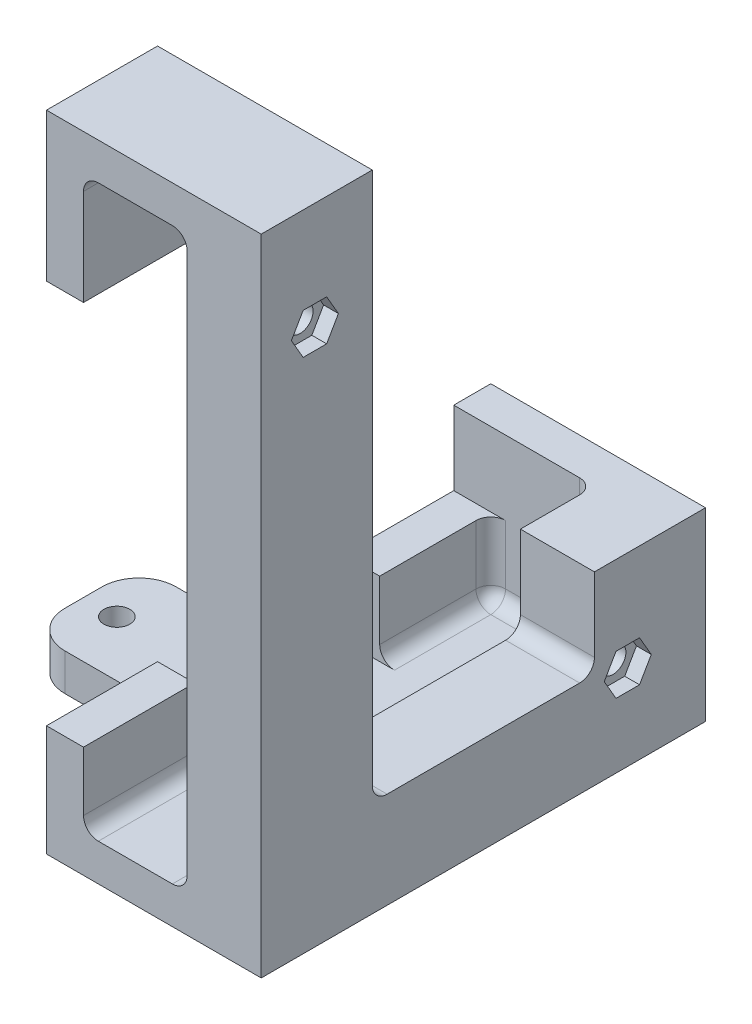
from build123d import *

# Parameters (mm, degrees)
BOSS_EXTRUDE1_DEPTH     = 15
BOSS_EXTRUDE2_DEPTH     = 60
SKETCH3_W               = 24
SKETCH3_H               = 25
BOSS_EXTRUDE3_DEPTH     = 5
FILLET1_R               = 2
CUT_EXTRUDE1_DEPTH      = 109.374351209
CUT_EXTRUDE1_DEPTH_BACK = 9
SKETCH5_W               = 30
SKETCH5_H               = 12
CUT_EXTRUDE2_DEPTH      = 9
FILLET2_R               = 2
FILLET3_R               = 2
FILLET4_R               = 2
SKETCH6_W               = 15
SKETCH6_H               = 10
BOSS_EXTRUDE4_DEPTH     = 5
FILLET5_R               = 2
BOSS_EXTRUDE6_START     = 5
BOSS_EXTRUDE6_DEPTH     = 5
SKETCH11_R              = 1.75
CUT_EXTRUDE6_DEPTH      = 17
CUT_EXTRUDE7_DEPTH      = 2
SKETCH16_R              = 1.75
BOSS_EXTRUDE7_DEPTH     = 5
SKETCH17_W              = 5
SKETCH17_H              = 35
BOSS_EXTRUDE8_DEPTH     = 10
FILLET6_R               = 2


with BuildPart() as part:
    # Sketch1 → Boss-Extrude1 (new body)
    with BuildSketch(Plane.XY):
        with BuildLine():
            Line((0, 0), (0, 87))
            Line((0, 87), (-24, 87))
            Line((-24, 87), (-24, 67))
            Line((-24, 67), (-19, 67))
            Line((-19, 67), (-19, 80))
            ThreePointArc((-19, 80), (-18.414213562, 81.414213562), (-17, 82))
            Line((-17, 82), (-7, 82))
            ThreePointArc((-7, 82), (-5.585786438, 81.414213562), (-5, 80))
            Line((-5, 80), (-5, 75.913258959))
            Line((-5, 75.913258959), (-5, 0))
            Line((-5, 0), (0, 0))
        make_face()
    extrude(amount=-BOSS_EXTRUDE1_DEPTH)

    # Sketch2 → Boss-Extrude2 (add)
    with BuildSketch(Plane.XY):
        Polygon((-5, 0), (-24, 0), (-24, 0.85250732), (-24, 15), (-19, 15), (-19, 5), (-5, 5), (-5, 25), (0, 25), (0, 0), align=None)
    extrude(amount=-BOSS_EXTRUDE2_DEPTH)

    # Sketch3 → Boss-Extrude3 (add)
    with BuildSketch(Plane(origin=(0, 0, -60), x_dir=(-1, 0, 0), z_dir=(0, 0, -1))):
        with Locations((12, 12.5)):
            Rectangle(SKETCH3_W, SKETCH3_H)
    extrude(amount=-BOSS_EXTRUDE3_DEPTH)

    # Fillet1
    fillet1_edges = [part.edges().sort_by_distance(p)[0] for p in [
        (-5, 5, -27.5),
        (-19, 5, -27.5),
    ]]
    fillet(fillet1_edges, radius=FILLET1_R)

    # Sketch4 → Cut-Extrude1 (cut, two sides: drawn at the far end of the back side and taken through both)
    with BuildSketch(Plane.ZY.offset(24).offset(-CUT_EXTRUDE1_DEPTH_BACK)):
        Polygon((-55, 206.20706388), (-55, 15), (-55, 5), (-15, 5), (-15, 15), (-15, 206.20706388), (-15, 588.62119164), (-55, 588.62119164), align=None)
    extrude(amount=CUT_EXTRUDE1_DEPTH + CUT_EXTRUDE1_DEPTH_BACK, mode=Mode.SUBTRACT)

    # Sketch5 → Cut-Extrude2 (cut)
    with BuildSketch(Plane.ZY.offset(5)):
        with Locations((-30, 19)):
            Rectangle(SKETCH5_W, SKETCH5_H)
    extrude(amount=-CUT_EXTRUDE2_DEPTH, mode=Mode.SUBTRACT)

    # Fillet2
    fillet2_edges = [part.edges().sort_by_distance(p)[0] for p in [
        (-5, 16, -55),
        (-15.5, 5, -55),
        (-5.585786438, 5.585786438, -55),
    ]]
    fillet(fillet2_edges, radius=FILLET2_R)

    # Fillet3
    fillet3_edges = [part.edges().sort_by_distance(p)[0] for p in [
        (-2.5, 13, -45),
    ]]
    fillet(fillet3_edges, radius=FILLET3_R)

    # Fillet4
    fillet4_edges = [part.edges().sort_by_distance(p)[0] for p in [
        (-2.5, 13, -15),
    ]]
    fillet(fillet4_edges, radius=FILLET4_R)

    # Sketch6 → Boss-Extrude4 (add)
    with BuildSketch(Plane.ZY.offset(24)):
        with Locations((-47.5, 10)):
            Rectangle(SKETCH6_W, SKETCH6_H)
    extrude(amount=-BOSS_EXTRUDE4_DEPTH)

    # Fillet5
    fillet5_edges = [part.edges().sort_by_distance(p)[0] for p in [
        (-19, 5.585786438, -54.414213562),
        (-19, 11, -55),
        (-19, 5, -46.5),
    ]]
    fillet(fillet5_edges, radius=FILLET5_R)

    # Sketch10 → Boss-Extrude6 (add)
    with BuildSketch(Plane(origin=(0, 0, 0), x_dir=(0, 0, -1), z_dir=(1, 0, 0)).offset(BOSS_EXTRUDE6_START)):
        with BuildLine():
            Line((43, 13), (17, 13))
            ThreePointArc((17, 13), (15.585786438, 13.585786438), (15, 15))
            Line((15, 15), (15, 87))
            Line((15, 87), (0, 87))
            Line((0, 87), (0, 0))
            Line((0, 0), (60, 0))
            Line((60, 0), (60, 25))
            Line((60, 25), (45, 25))
            Line((45, 25), (45, 15))
            ThreePointArc((45, 15), (44.414213562, 13.585786438), (43, 13))
        make_face()
    extrude(amount=-BOSS_EXTRUDE6_DEPTH)

    # Sketch11 → Cut-Extrude6 (cut)
    with BuildSketch(Plane(origin=(5, 0, 0), x_dir=(0, 0, -1), z_dir=(1, 0, 0))):
        with Locations(Location((49.5, 11.5, 0), (0, 0, 90))):
            Circle(SKETCH11_R)
        with Locations(Location((7.248390946, 72.5, 0), (0, 0, 90))):
            Circle(SKETCH11_R)
    extrude(amount=-CUT_EXTRUDE6_DEPTH, mode=Mode.SUBTRACT)

    # Sketch14 → Cut-Extrude7 (cut)
    with BuildSketch(Plane(origin=(5, 0, 0), x_dir=(0, 0, -1), z_dir=(1, 0, 0))):
        Polygon((10.423817427, 72.5), (8.836104186, 75.25), (5.660677706, 75.25), (4.072964465, 72.5), (5.660677706, 69.75), (8.836104186, 69.75), align=None)
        Polygon((52.675426481, 11.5), (51.08771324, 14.25), (47.91228676, 14.25), (46.324573519, 11.5), (47.91228676, 8.75), (51.08771324, 8.75), align=None)
    extrude(amount=-CUT_EXTRUDE7_DEPTH, mode=Mode.SUBTRACT)

    # Sketch16 → Boss-Extrude7 (add)
    with BuildSketch(Plane(origin=(0, 0, 0), x_dir=(1, 0, 0), z_dir=(0, 1, 0))):
        with BuildLine():
            Line((-24, 35), (-41.5, 35))
            ThreePointArc((-41.5, 35), (-45.035533906, 33.535533906), (-46.5, 30))
            Line((-46.5, 30), (-46.5, 25))
            ThreePointArc((-46.5, 25), (-45.035533906, 21.464466094), (-41.5, 20))
            Line((-41.5, 20), (-24, 20))
            Line((-24, 20), (-24, 35))
        make_face()
        with Locations(Location((-42, 27.5, 0), (0, 0, 180))):
            Circle(SKETCH16_R, mode=Mode.SUBTRACT)
    extrude(amount=BOSS_EXTRUDE7_DEPTH)

    # Sketch17 → Boss-Extrude8 (add)
    with BuildSketch(Plane.XZ):
        with Locations((-9.5, -30)):
            Rectangle(SKETCH17_W, SKETCH17_H)
    extrude(amount=BOSS_EXTRUDE8_DEPTH)

    # Fillet6
    fillet6_edges = [part.edges().sort_by_distance(p)[0] for p in [
        (-9.5, -10, -12.5),
        (-9.5, -10, -47.5),
    ]]
    fillet(fillet6_edges, radius=FILLET6_R)


solid = part.part
